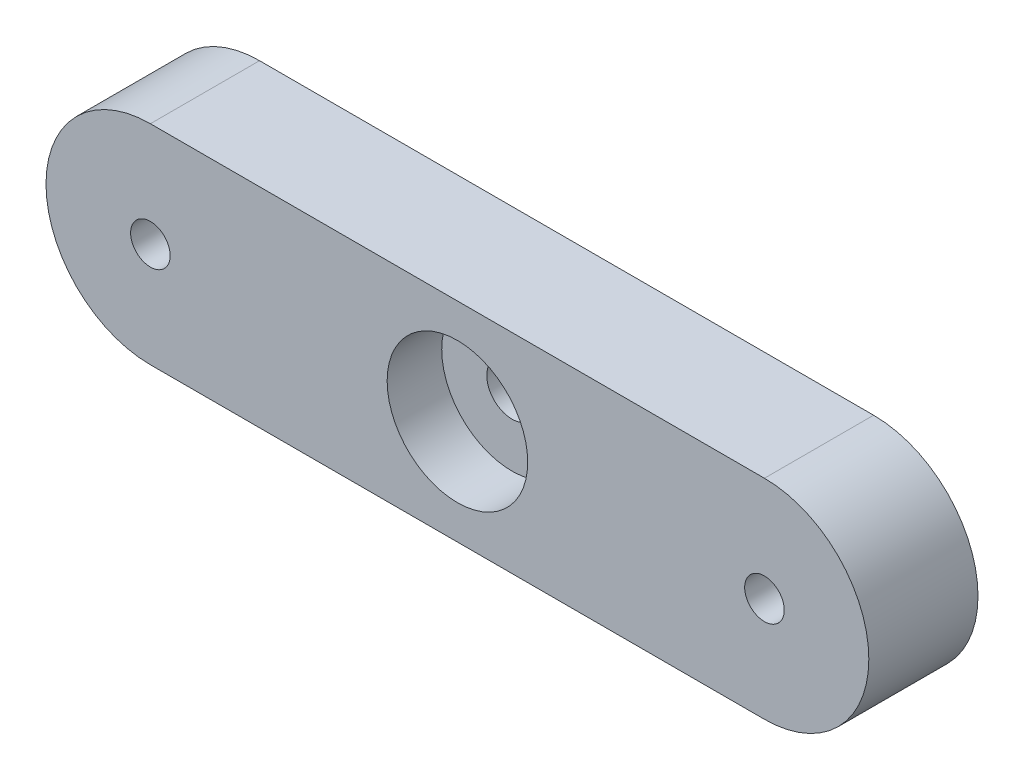
from build123d import *

# Parameters (mm, degrees)
SKETCH_1_R      = 1.45
SKETCH_1_R_2    = 5.15
EXTRUDE_1_DEPTH = 8
SKETCH_2_R      = 5.305373799
SKETCH_2_R_2    = 1.85
EXTRUDE_2_DEPTH = 4


with BuildPart() as part:
    # Эскиз1 → Бобышка-Вытянуть1 (new body)
    with BuildSketch(Plane.XY):
        with BuildLine():
            Line((0, 7.65), (45, 7.65))
            ThreePointArc((45, 7.65), (52.65, 0), (45, -7.65))
            Line((45, -7.65), (0, -7.65))
            ThreePointArc((0, -7.65), (-7.65, 0), (0, 7.65))
        make_face()
        Circle(SKETCH_1_R, mode=Mode.SUBTRACT)
        with Locations((45, 0)):
            Circle(SKETCH_1_R, mode=Mode.SUBTRACT)
        with Locations((22.5, 0)):
            Circle(SKETCH_1_R_2, mode=Mode.SUBTRACT)
    extrude(amount=EXTRUDE_1_DEPTH)

    # Эскиз2 → Бобышка-Вытянуть2 (add)
    with BuildSketch(Plane(origin=(0, 0, 0), x_dir=(-1, 0, 0), z_dir=(0, 0, -1))):
        with Locations((-22.5, 0)):
            Circle(SKETCH_2_R)
        with Locations((-22.5, 0)):
            Circle(SKETCH_2_R_2, mode=Mode.SUBTRACT)
    extrude(amount=-EXTRUDE_2_DEPTH)


solid = part.part
